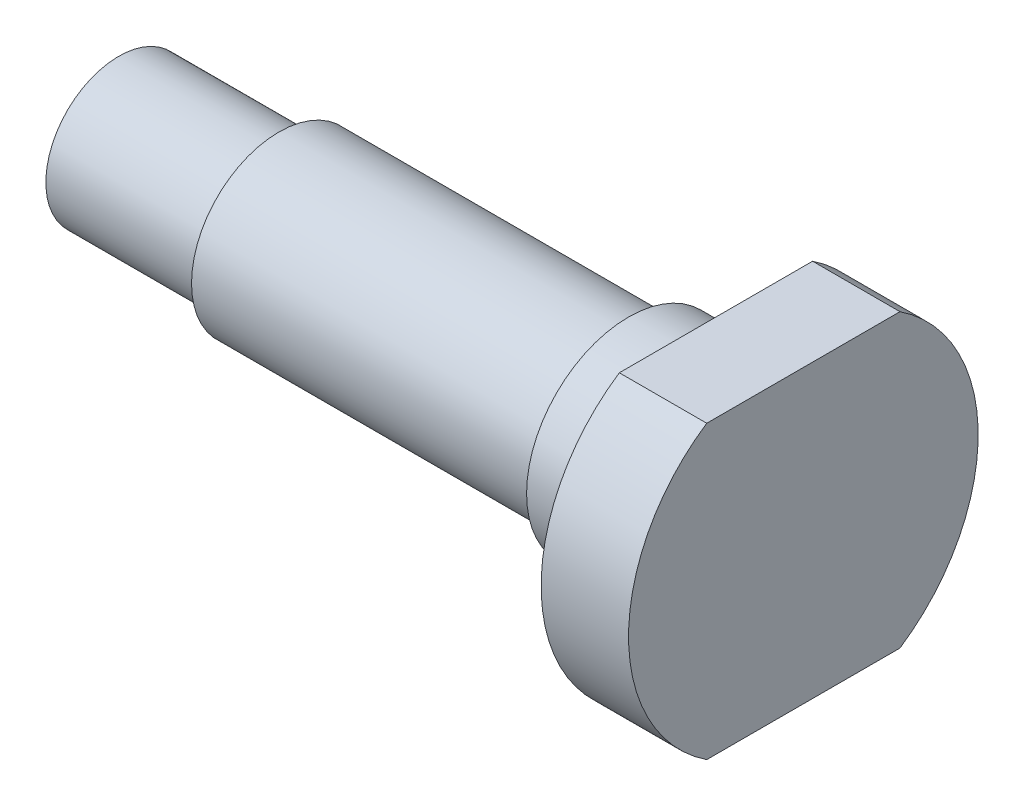
from build123d import *

# Parameters (mm, degrees)
BOSS_EXTRUDE1_DEPTH = 3
BOSS_EXTRUDE2_DEPTH = 15
BOSS_EXTRUDE3_DEPTH = 20.5
BOSS_EXTRUDE4_DEPTH = 3


with BuildPart() as part:
    # Sketch2 → Boss-Extrude1 (new body)
    with BuildSketch(Plane(origin=(0, 0, 0), x_dir=(0, 0, -1), z_dir=(1, 0, 0))):
        with BuildLine():
            Line((3.31662479, 5), (-3.31662479, 5))
            ThreePointArc((-3.31662479, 5), (-5.286764074, 2.837274331), (-6, 0))
            ThreePointArc((-6, 0), (-5.286764074, -2.837274331), (-3.31662479, -5))
            Line((-3.31662479, -5), (3.31662479, -5))
            ThreePointArc((3.31662479, -5), (6, 0), (3.31662479, 5))
        make_face()
    extrude(amount=BOSS_EXTRUDE1_DEPTH)

    # Sketch2<4> → Boss-Extrude2 (add)
    with BuildSketch(Plane(origin=(0, 0, 0), x_dir=(0, 0, -1), z_dir=(1, 0, 0))):
        with BuildLine():
            ThreePointArc((3, 0), (0, 3), (-3, 0))
            ThreePointArc((-3, 0), (0, -3), (3, 0))
        make_face()
        with BuildLine():
            ThreePointArc((2.5, 0), (0, -2.5), (-2.5, 0))
            ThreePointArc((-2.5, 0), (0, 2.5), (2.5, 0))
        make_face(mode=Mode.SUBTRACT)
    extrude(amount=-BOSS_EXTRUDE2_DEPTH)

    # Sketch2<5> → Boss-Extrude3 (add)
    with BuildSketch(Plane(origin=(0, 0, 0), x_dir=(0, 0, -1), z_dir=(1, 0, 0))):
        with BuildLine():
            ThreePointArc((2.5, 0), (0, 2.5), (-2.5, 0))
            ThreePointArc((-2.5, 0), (0, -2.5), (2.5, 0))
        make_face()
    extrude(amount=-BOSS_EXTRUDE3_DEPTH)

    # Sketch2<6> → Boss-Extrude4 (add)
    with BuildSketch(Plane(origin=(0, 0, 0), x_dir=(0, 0, -1), z_dir=(1, 0, 0))):
        with BuildLine():
            ThreePointArc((3.5, 0), (0, 3.5), (-3.5, 0))
            ThreePointArc((-3.5, 0), (0, -3.5), (3.5, 0))
        make_face()
        with BuildLine():
            ThreePointArc((3, 0), (0, -3), (-3, 0))
            ThreePointArc((-3, 0), (0, 3), (3, 0))
        make_face(mode=Mode.SUBTRACT)
    extrude(amount=-BOSS_EXTRUDE4_DEPTH)


solid = part.part
